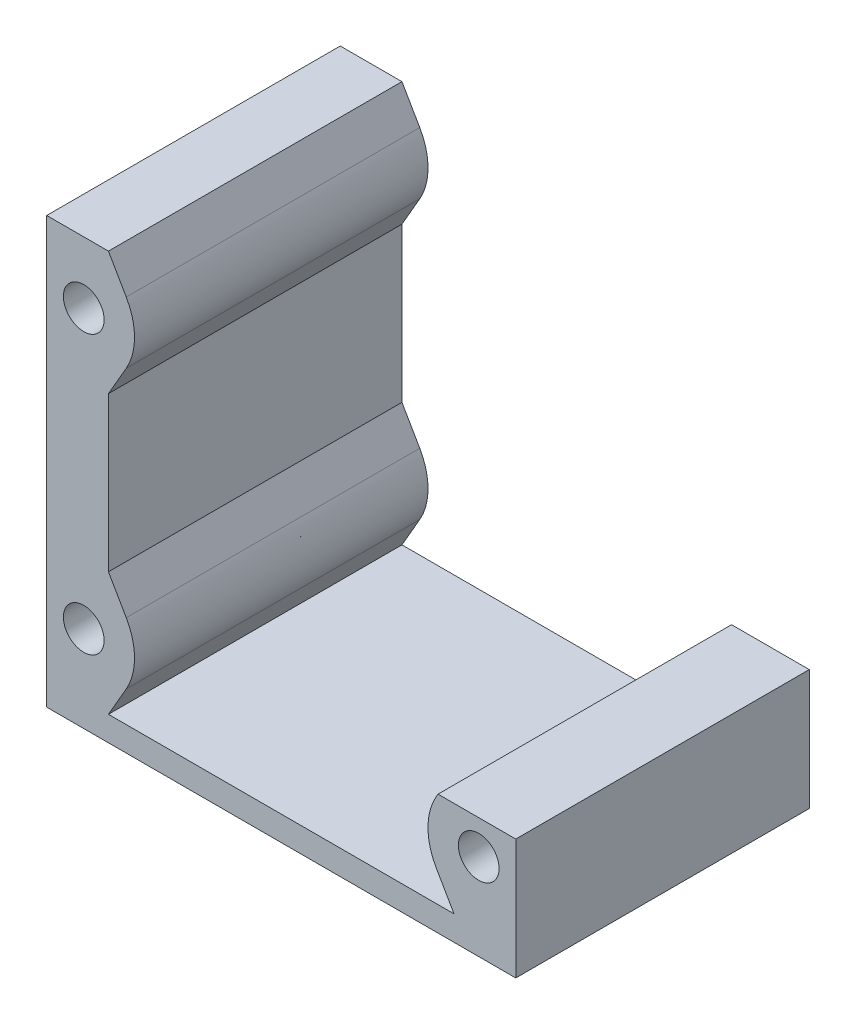
from build123d import *

# Parameters (mm, degrees)
SKIZZE1_W                       = 47.557374535
SKIZZE1_H                       = 4
AUFSATZ_LINEAR_AUSTRAGEN1_DEPTH = 76
AUFSATZ_LINEAR_AUSTRAGEN2_DEPTH = 47.557374535
VERRUNDUNG1_R                   = 10
SKIZZE3_R                       = 3.3
SCHNITT_LINEAR_AUSTRAGEN1_DEPTH = 47.557374535
SKIZZE4_W                       = 47.557374535
SKIZZE4_H                       = 15
SCHNITT_LINEAR_AUSTRAGEN2_DEPTH = 30
SKIZZE5_W                       = 47.557374535
SKIZZE5_H                       = 34.5
TEMPOR_R_DEPTH                  = 20


with BuildPart() as part:
    # Skizze1 → Aufsatz-Linear austragen1 (new body)
    with BuildSketch(Plane.ZY.offset(38)):
        with Locations((46.278687268, -2)):
            Rectangle(SKIZZE1_W, SKIZZE1_H)
    extrude(amount=-AUFSATZ_LINEAR_AUSTRAGEN1_DEPTH)

    # Skizze2 → Aufsatz-Linear austragen2 (add)
    with BuildSketch(Plane.XY.offset(22.5)):
        Polygon((-38, 65), (-38, 0), (-28, 0), (-22.226497308, 10), (-28, 20), (-28, 45), (-22.226497308, 55), (-28, 65), align=None)
        Polygon((28, 65), (38, 65), (38, 0), (28, 0), (22.226497308, 10), (28, 20), (28, 45), (22.226497308, 55), align=None)
    extrude(amount=AUFSATZ_LINEAR_AUSTRAGEN2_DEPTH)

    # Verrundung1
    verrundung1_edges = [part.edges().sort_by_distance(p)[0] for p in [
        (-22.226497308, 10, 46.278687268),
        (-22.226497308, 55, 46.278687268),
        (22.226497308, 55, 46.278687268),
        (22.226497308, 10, 46.278687268),
    ]]
    fillet(verrundung1_edges, radius=VERRUNDUNG1_R)

    # Skizze3 → Schnitt-Linear austragen1 (cut)
    with BuildSketch(Plane(origin=(0, 0, 22.5), x_dir=(-1, 0, 0), z_dir=(0, 0, -1))):
        with Locations((32, 10)):
            Circle(SKIZZE3_R)
        with Locations((32, 55)):
            Circle(SKIZZE3_R)
        with Locations((-32, 55)):
            Circle(SKIZZE3_R)
        with Locations((-32, 10)):
            Circle(SKIZZE3_R)
    extrude(amount=-SCHNITT_LINEAR_AUSTRAGEN1_DEPTH, mode=Mode.SUBTRACT)

    # Skizze4 → Schnitt-Linear austragen2 (cut)
    with BuildSketch(Plane.ZY.offset(-38)):
        with Locations((46.278687268, 23)):
            Rectangle(SKIZZE4_W, SKIZZE4_H)
    extrude(amount=SCHNITT_LINEAR_AUSTRAGEN2_DEPTH, mode=Mode.SUBTRACT)


with BuildPart() as schnitt_linear_austragen2_piece_1:
    # of the separate pieces the step leaves, piece 1, a body of its own (schnitt_linear_austragen2_pieces)
    add(part.part.solids().sort_by_distance((38, 15.5, 22.5))[0])


with BuildPart() as schnitt_linear_austragen2_piece_2:
    # of the separate pieces the step leaves, piece 2, a body of its own (schnitt_linear_austragen2_pieces)
    add(part.part.solids().sort_by_distance((25.113248654, 60, 22.5))[0])

    # Skizze5 → temporär (cut)
    with BuildSketch(Plane(origin=(38, 0, 0), x_dir=(0, 0, -1), z_dir=(1, 0, 0))):
        with Locations((-46.278687268, 47.75)):
            Rectangle(SKIZZE5_W, SKIZZE5_H)
    extrude(amount=-TEMPOR_R_DEPTH, mode=Mode.SUBTRACT)


solid = schnitt_linear_austragen2_piece_1.part
